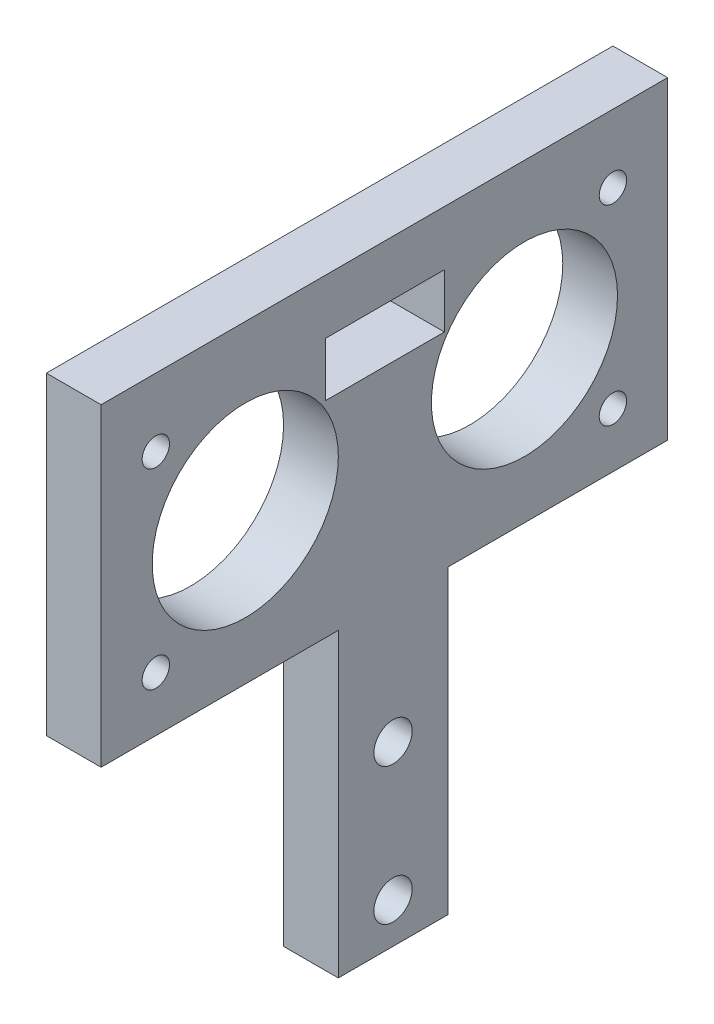
from build123d import *

# Parameters (mm, degrees)
BOSS_EXTRUDE1_DEPTH = 5.08
SKETCH2_W           = 101.6
SKETCH2_H           = 10.16
CUT_EXTRUDE3_DEPTH  = 22.86
SKETCH9_R           = 1.27
CUT_EXTRUDE4_DEPTH  = 25.908
SKETCH13_W          = 11.0236
SKETCH13_H          = 5.0038
CUT_EXTRUDE5_DEPTH  = 25.908
SKETCH8_R           = 8.636
CUT_EXTRUDE6_DEPTH  = 25.908
SKETCH14_W          = 212.203069611
SKETCH14_H          = 122.52066239
SKETCH14_W_2        = 52.5744
SKETCH14_H_2        = 29.137232508
CUT_EXTRUDE7_DEPTH  = 25.908
SKETCH15_W          = 52.5744
SKETCH15_H          = 43.722211583
BOSS_EXTRUDE2_DEPTH = 5.08
SKETCH17_W          = 25.579382718
SKETCH17_H          = 36.902767492
CUT_EXTRUDE8_DEPTH  = 10.16
SKETCH18_R          = 1.7526
CUT_EXTRUDE9_DEPTH  = 10.16
SKETCH19_W          = 77.987144431
SKETCH19_H          = 16.36926668
CUT_EXTRUDE10_DEPTH = 19.05
SKETCH20_R          = 1.778
CUT_EXTRUDE11_DEPTH = 19.05


with BuildPart() as part:
    # Sketch1 → Boss-Extrude1 (new body)
    with BuildSketch(Plane(origin=(0, 0, 0), x_dir=(0, 0, -1), z_dir=(1, 0, 0))):
        Polygon((62.997029703, -55.82970297), (88.397029703, -55.82970297), (88.397029703, -65.98970297), (-89.402970297, -65.98970297), (-89.402970297, -55.82970297), (-64.002970297, -55.82970297), (-64.002970297, 27.837475742), (62.997029703, 27.837475742), align=None)
    extrude(amount=BOSS_EXTRUDE1_DEPTH)

    # Sketch2 → Cut-Extrude3 (cut)
    with BuildSketch(Plane(origin=(0, 0, 0), x_dir=(0, 0, -1), z_dir=(1, 0, 0))):
        with Locations((-0.502970297, -60.90970297)):
            Rectangle(SKETCH2_W, SKETCH2_H)
    extrude(amount=CUT_EXTRUDE3_DEPTH, mode=Mode.SUBTRACT)

    # Sketch9 → Cut-Extrude4 (cut)
    with BuildSketch(Plane(origin=(0, 0, 0), x_dir=(0, 0, -1), z_dir=(1, 0, 0))):
        with Locations((-22.010170297, -1.223907747)):
            Circle(SKETCH9_R)
        with Locations(Location((-22.010170297, -18.977232508, 0), (0, 0, 180))):
            Circle(SKETCH9_R)
        with Locations((20.404229703, -18.977232508)):
            Circle(SKETCH9_R)
        with Locations(Location((20.404229703, -1.223907747, 0), (0, 0, 180))):
            Circle(SKETCH9_R)
    extrude(amount=CUT_EXTRUDE4_DEPTH, mode=Mode.SUBTRACT)

    # Sketch13 → Cut-Extrude5 (cut)
    with BuildSketch(Plane(origin=(0, 0, 0), x_dir=(0, 0, -1), z_dir=(1, 0, 0))):
        with Locations((-0.746414126, -2.5019)):
            Rectangle(SKETCH13_W, SKETCH13_H)
    extrude(amount=CUT_EXTRUDE5_DEPTH, mode=Mode.SUBTRACT)

    # Sketch8 → Cut-Extrude6 (cut)
    with BuildSketch(Plane(origin=(0, 0, 0), x_dir=(0, 0, -1), z_dir=(1, 0, 0))):
        with Locations((12.197029703, -10.100570128)):
            Circle(SKETCH8_R)
        with Locations((-13.710970297, -10.100570128)):
            Circle(SKETCH8_R)
    extrude(amount=CUT_EXTRUDE6_DEPTH, mode=Mode.SUBTRACT)

    # Sketch14 → Cut-Extrude7 (cut)
    with BuildSketch(Plane(origin=(0, 0, 0), x_dir=(0, 0, -1), z_dir=(1, 0, 0))):
        with Locations((-5.581398167, -16.698007888)):
            Rectangle(SKETCH14_W, SKETCH14_H)
        with Locations((-0.802970297, -9.488616254)):
            Rectangle(SKETCH14_W_2, SKETCH14_H_2, mode=Mode.SUBTRACT)
    extrude(amount=CUT_EXTRUDE7_DEPTH, mode=Mode.SUBTRACT)

    # Sketch15 → Boss-Extrude2 (add)
    with BuildSketch(Plane(origin=(0, 0, 0), x_dir=(0, 0, -1), z_dir=(1, 0, 0))):
        with Locations((-0.802970297, -44.178894209)):
            Rectangle(SKETCH15_W, SKETCH15_H)
    extrude(amount=BOSS_EXTRUDE2_DEPTH)

    # Sketch17 → Cut-Extrude8 (cut)
    with BuildSketch(Plane(origin=(0, 0, 0), x_dir=(0, 0, -1), z_dir=(1, 0, 0))):
        with Locations((-17.869691359, -42.508616254)):
            Rectangle(SKETCH17_W, SKETCH17_H)
        with Locations((17.869691359, -42.508616254)):
            Rectangle(SKETCH17_W, SKETCH17_H)
    extrude(amount=CUT_EXTRUDE8_DEPTH, mode=Mode.SUBTRACT)

    # Sketch18 → Cut-Extrude9 (cut)
    with BuildSketch(Plane(origin=(0, -66.04, 0), x_dir=(1, 0, 0), z_dir=(0, 1, 0))):
        with Locations((0, -22.010170297)):
            Circle(SKETCH18_R)
        with Locations((0, 20.404229703)):
            Circle(SKETCH18_R)
    extrude(amount=CUT_EXTRUDE9_DEPTH, mode=Mode.SUBTRACT)

    # Sketch19 → Cut-Extrude10 (cut)
    with BuildSketch(Plane(origin=(0, 0, 0), x_dir=(0, 0, -1), z_dir=(1, 0, 0))):
        with Locations((-1.479514925, -60.181865848)):
            Rectangle(SKETCH19_W, SKETCH19_H)
    extrude(amount=CUT_EXTRUDE10_DEPTH, mode=Mode.SUBTRACT)

    # Sketch20 → Cut-Extrude11 (cut)
    with BuildSketch(Plane(origin=(0, 0, 0), x_dir=(0, 0, -1), z_dir=(1, 0, 0))):
        with Locations(Location((0, -48.26, 0), (0, 0, 180))):
            Circle(SKETCH20_R)
        with Locations(Location((0, -35.56, 0), (0, 0, 180))):
            Circle(SKETCH20_R)
    extrude(amount=CUT_EXTRUDE11_DEPTH, mode=Mode.SUBTRACT)


solid = part.part
